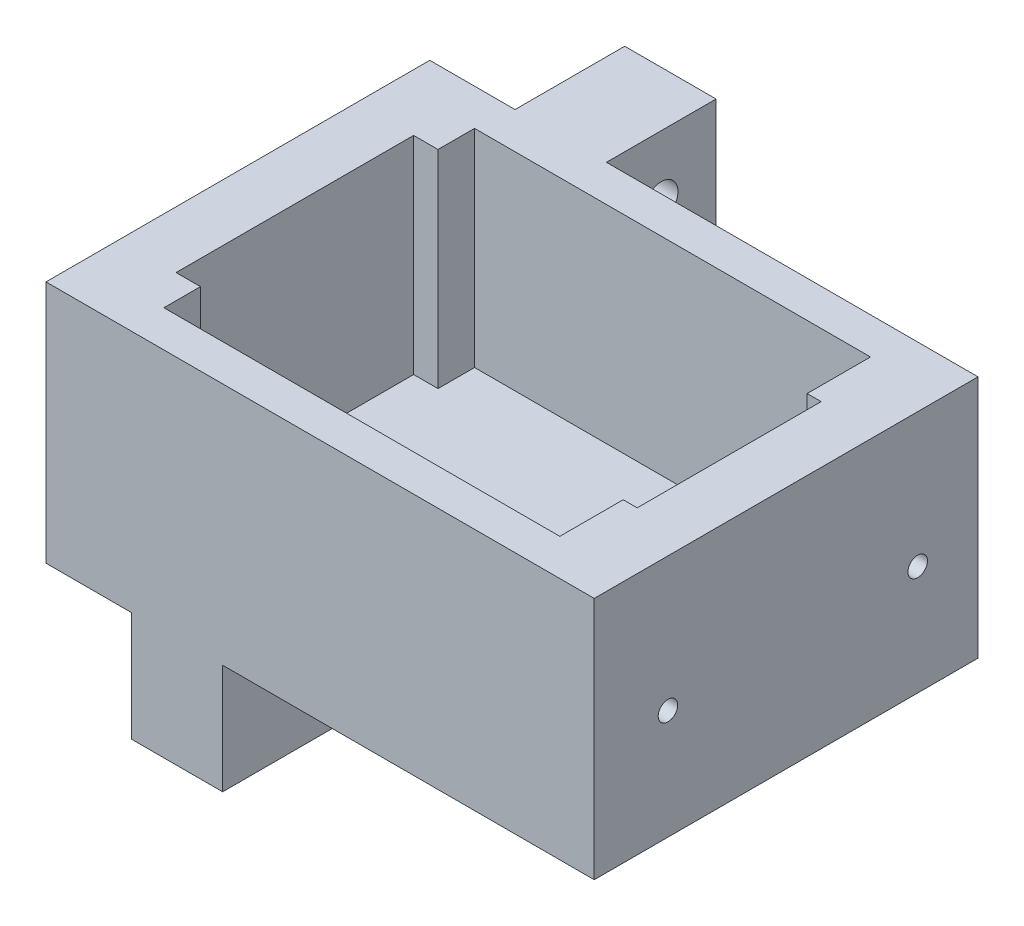
from build123d import *

# Parameters (mm, degrees)
SKETCH1_W           = 45
SKETCH1_H           = 31.5
BOSS_EXTRUDE1_DEPTH = 20
CUT_EXTRUDE1_DEPTH  = 17
SKETCH3_R           = 0.8
CUT_EXTRUDE2_DEPTH  = 5.825
BOSS_EXTRUDE2_START = -7
SKETCH5_W           = 30.5
SKETCH5_H           = 9
SKETCH5_R           = 1.375
SKETCH5_W_2         = 9
SKETCH5_H_2         = 20
BOSS_EXTRUDE2_DEPTH = 7.5


with BuildPart() as part:
    # Sketch1 → Boss-Extrude1 (new body)
    with BuildSketch(Plane(origin=(0, 0, 0), x_dir=(1, 0, 0), z_dir=(0, 1, 0))):
        with Locations((22.5, 15.75)):
            Rectangle(SKETCH1_W, SKETCH1_H)
    extrude(amount=BOSS_EXTRUDE1_DEPTH)

    # Sketch2 → Cut-Extrude1 (cut)
    with BuildSketch(Plane(origin=(0, 20, 0), x_dir=(1, 0, 0), z_dir=(0, 1, 0))):
        Polygon((39.175, 28.5), (6.675, 28.5), (6.675, 25.5), (4.675, 25.5), (4.675, 6), (6.675, 6), (6.675, 3), (39.175, 3), (39.175, 8.2), (40.325, 8.2), (40.325, 23.3), (39.175, 23.3), align=None)
    extrude(amount=-CUT_EXTRUDE1_DEPTH, mode=Mode.SUBTRACT)

    # Sketch3 → Cut-Extrude2 (cut)
    with BuildSketch(Plane.ZY.offset(-39.175)):
        with Locations((-26.55, 9)):
            Circle(SKETCH3_R)
        with Locations((-6.05, 9)):
            Circle(SKETCH3_R)
    extrude(amount=-CUT_EXTRUDE2_DEPTH, mode=Mode.SUBTRACT)

    # Sketch5 → Boss-Extrude2 (add)
    # profile 1 of 2: a face of its own
    with BuildSketch(Plane.ZY.offset(BOSS_EXTRUDE2_START)):
        with Locations((-15.25, -4.5)):
            Rectangle(SKETCH5_W, SKETCH5_H)
        with Locations((-24, -4.5)):
            Circle(SKETCH5_R, mode=Mode.SUBTRACT)
        with Locations((-7.5, -4.5)):
            Circle(SKETCH5_R, mode=Mode.SUBTRACT)
    # profile 2 of 2: a face of its own
    with BuildSketch(Plane.ZY.offset(BOSS_EXTRUDE2_START)):
        with Locations((-36, 10)):
            Rectangle(SKETCH5_W_2, SKETCH5_H_2)
        with Locations((-36, 5)):
            Circle(SKETCH5_R, mode=Mode.SUBTRACT)
        with Locations((-36, 15)):
            Circle(SKETCH5_R, mode=Mode.SUBTRACT)
    extrude(amount=-BOSS_EXTRUDE2_DEPTH)


solid = part.part
